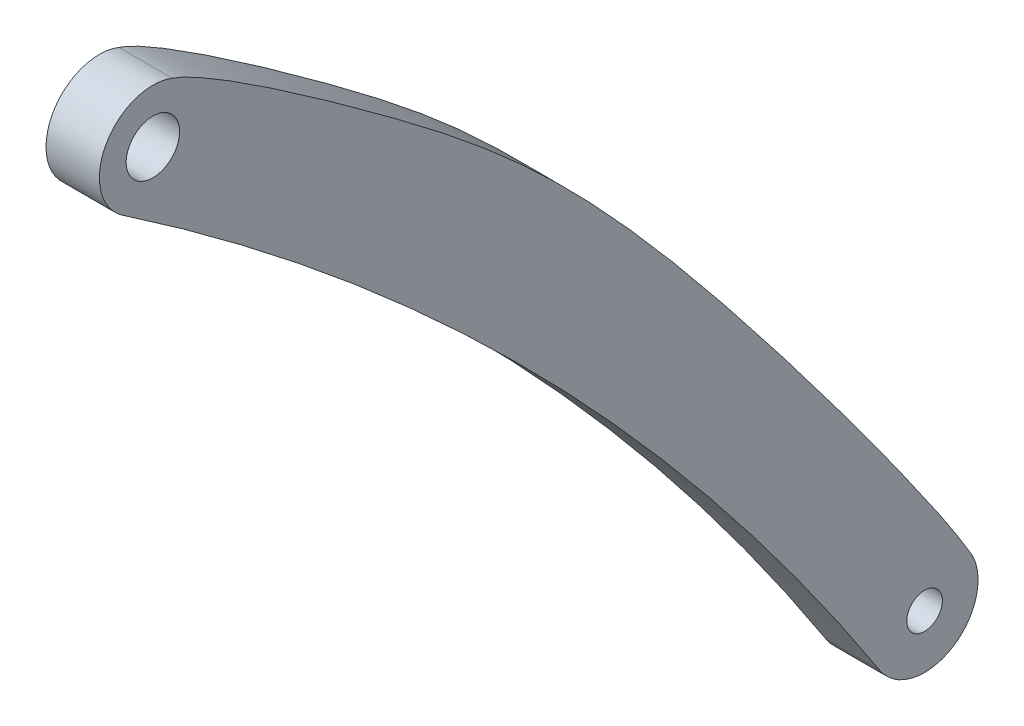
from build123d import *

# Parameters (mm, degrees)
SKETCH3_R               = 1
SKETCH3_R_2             = 1.5
BOSS_EXTRUDE3_DEPTH     = 3
SCALE1_SCALE            = 2
CUT_EXTRUDE1_DEPTH      = 221.773250552
CUT_EXTRUDE1_DEPTH_BACK = 221.773250552


with BuildPart() as part:
    # Sketch3 → Boss-Extrude3 (new body)
    with BuildSketch(Plane.YZ):
        with BuildLine():
            ThreePointArc((85.286443942, 65.55056259), (103.116861263, 80.165410908), (118.092599751, 97.693811573))
            ThreePointArc((118.092599751, 97.693811573), (133.598383509, 107.27552243), (130.534429587, 89.307475813))
            ThreePointArc((130.534429587, 89.307475813), (113.614659803, 69.451110846), (93.417083732, 52.940152059))
            ThreePointArc((93.417083732, 52.940152059), (75.390242246, 50.243580365), (85.286443942, 65.55056259))
        make_face()
        with Locations(Location((83.794759513, 55.662444591, 0), (0, 0, 270))):
            Circle(SKETCH3_R, mode=Mode.SUBTRACT)
        with Locations(Location((128.009104434, 98.9833599, 0), (0, 0, 270))):
            Circle(SKETCH3_R_2, mode=Mode.SUBTRACT)
    extrude(amount=BOSS_EXTRUDE3_DEPTH)


with BuildPart() as part_1:
    # Scale1: scaled about (1.5, 106.955102549, 76.112942123)
    add(part.part.scale(SCALE1_SCALE).moved(Location((-1.5, -106.955102549, -76.112942123))))

    # Sketch4 → Cut-Extrude1 (cut, two sides: drawn at the far end of the back side and taken through both)
    # profile 1 of 2: a face of its own
    with BuildSketch(Plane.YZ.offset(4.5).offset(-CUT_EXTRUDE1_DEPTH_BACK)):
        with BuildLine():
            ThreePointArc((88.183726829, 23.336110281), (127.272749417, 55.646412862), (160.374162964, 94.067810039))
            ThreePointArc((160.374162964, 94.067810039), (165.982617362, 146.627355256), (119.06613126, 122.279790983))
            ThreePointArc((119.06613126, 122.279790983), (92.280087616, 91.3607464), (60.820757061, 65.211368339))
            ThreePointArc((60.820757061, 65.211368339), (35.520657449, 18.801611674), (88.183726829, 23.336110281))
        make_face()
        with BuildLine():
            ThreePointArc((129.230096954, 119.274681024), (99.278619977, 84.217879693), (63.617785336, 54.988183056))
            ThreePointArc((63.617785336, 54.988183056), (43.825381943, 24.374218606), (79.879064915, 29.767361994))
            ThreePointArc((79.879064915, 29.767361994), (120.274217057, 62.78927957), (154.113756626, 102.502009503))
            ThreePointArc((154.113756626, 102.502009503), (160.241664469, 138.438102737), (129.230096954, 119.274681024))
        make_face(mode=Mode.SUBTRACT)
    # profile 2 of 2: a face of its own
    with BuildSketch(Plane.YZ.offset(4.5).offset(-CUT_EXTRUDE1_DEPTH_BACK)):
        with BuildLine():
            ThreePointArc((154.113756626, 102.502009503), (160.241664469, 138.438102737), (129.230096954, 119.274681024))
            ThreePointArc((129.230096954, 119.274681024), (99.278619977, 84.217879693), (63.617785336, 54.988183056))
            ThreePointArc((63.617785336, 54.988183056), (43.825381943, 24.374218606), (79.879064915, 29.767361994))
            ThreePointArc((79.879064915, 29.767361994), (120.274217057, 62.78927957), (154.113756626, 102.502009503))
        make_face()
        with BuildLine():
            ThreePointArc((63.695966872, 30.051820201), (55.534775112, 32.050672324), (57.374611965, 40.249175913))
            ThreePointArc((57.374611965, 40.249175913), (105.014353395, 78.363855281), (144.093462371, 125.215717449))
            ThreePointArc((144.093462371, 125.215717449), (151.698622928, 127.243958769), (154.768335401, 119.996262907))
            ThreePointArc((154.768335401, 119.996262907), (154.707974363, 119.820193462), (154.642181096, 119.646080998))
            add(Edge.make_bspline(
                [(63.695966872, 30.051820201), (71.268804507, 34.544853938), (116.169708626, 67.672774066), (134.037170487, 87.763772771), (153.494381638, 116.0792592), (154.642181096, 119.646080998)],
                knots=[0, 0, 0, 0, 0.217779275, 0.657591192, 0.944552217, 0.944552217, 0.944552217, 0.944552217], degree=3))
        make_face(mode=Mode.SUBTRACT)
    extrude(amount=CUT_EXTRUDE1_DEPTH + CUT_EXTRUDE1_DEPTH_BACK, mode=Mode.SUBTRACT)


solid = part_1.part
